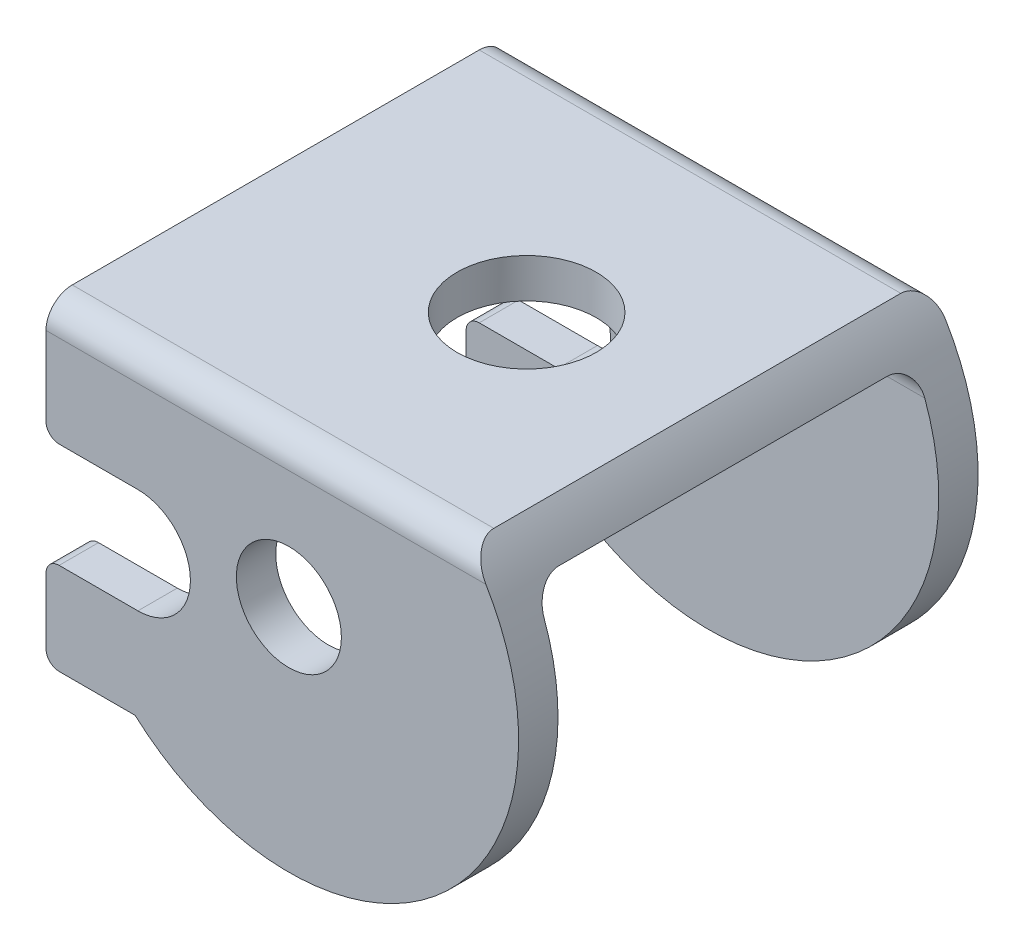
from build123d import *

# Parameters (mm, degrees)
EXTRUDE_1_DEPTH     = 17.5
SKETCH_2_R          = 4
CUT_EXTRUDE_1_DEPTH = 44.283946216
SKETCH_3_W          = 29
SKETCH_3_H          = 25.5
CUT_EXTRUDE_2_DEPTH = 44.686382318
CUT_EXTRUDE_3_REACH = 40.22
SKETCH_4_R          = 5.3
FILLET_1_R          = 1
FILLET_2_R          = 2


with BuildPart() as part:
    # ｽｹｯﾁ1 → ﾎﾞｽ - 押し出し1 (new, symmetric)
    with BuildSketch(Plane.XY):
        with BuildLine():
            Line((-18.5, 11), (-18.5, -13))
            Line((-18.5, -13), (-11.715374514, -13))
            ThreePointArc((-11.715374514, -13), (12.037359531, -12.702439747), (13.610657589, 11))
            Line((13.610657589, 11), (-18.5, 11))
        make_face()
    extrude(amount=EXTRUDE_1_DEPTH, both=True)

    # ｽｹｯﾁ2 → ｶｯﾄ - 押し出し1 (cut, through all)
    with BuildSketch(Plane.XY.offset(17.5)):
        Circle(SKETCH_2_R)
        with BuildLine():
            Line((-18.5, 2), (-11.5, 2))
            ThreePointArc((-11.5, 2), (-7.5, -2), (-11.5, -6))
            Line((-11.5, -6), (-18.5, -6))
            Line((-18.5, -6), (-18.5, 2))
        make_face()
    extrude(amount=-CUT_EXTRUDE_1_DEPTH, mode=Mode.SUBTRACT)

    # ｽｹｯﾁ3 → ｶｯﾄ - 押し出し2 (cut, through all)
    with BuildSketch(Plane.ZY.offset(18.5)):
        with Locations((0, -4.75)):
            Rectangle(SKETCH_3_W, SKETCH_3_H)
    extrude(amount=-CUT_EXTRUDE_2_DEPTH, mode=Mode.SUBTRACT)

    # ｽｹｯﾁ4 → ｶｯﾄ - 押し出し3 (cut, up to next)
    with BuildSketch(Plane(origin=(0, 11, 0), x_dir=(1, 0, 0), z_dir=(0, 1, 0)), mode=Mode.PRIVATE) as cut_extrude_3_sk1:
        with Locations(Location((0.610657589, 0, 0), (0, 0, 270))):
            Circle(SKETCH_4_R)
    cut_extrude_3_tool1 = extrude(cut_extrude_3_sk1.sketch, amount=-CUT_EXTRUDE_3_REACH, mode=Mode.PRIVATE) & part.part
    add(cut_extrude_3_tool1.solids().sort_by_distance((0.610658, 11, 0))[0], mode=Mode.SUBTRACT)

    # ﾌｨﾚｯﾄ1
    fillet_1_edges = [part.edges().sort_by_distance(p)[0] for p in [
        (-18.5, -6, -16),
        (-18.5, 2, -16),
        (-18.5, -6, 16),
        (-18.5, 2, 16),
        (-18.5, -13, -16),
        (-18.5, -13, 16),
    ]]
    fillet(fillet_1_edges, radius=FILLET_1_R)

    # ﾌｨﾚｯﾄ2
    fillet_2_edges = [part.edges().sort_by_distance(p)[0] for p in [
        (-2.444671206, 11, 17.5),
        (-1.467808792, 8, -14.5),
        (-1.467808792, 8, 14.5),
        (-2.444671206, 11, -17.5),
    ]]
    fillet(fillet_2_edges, radius=FILLET_2_R)


solid = part.part
